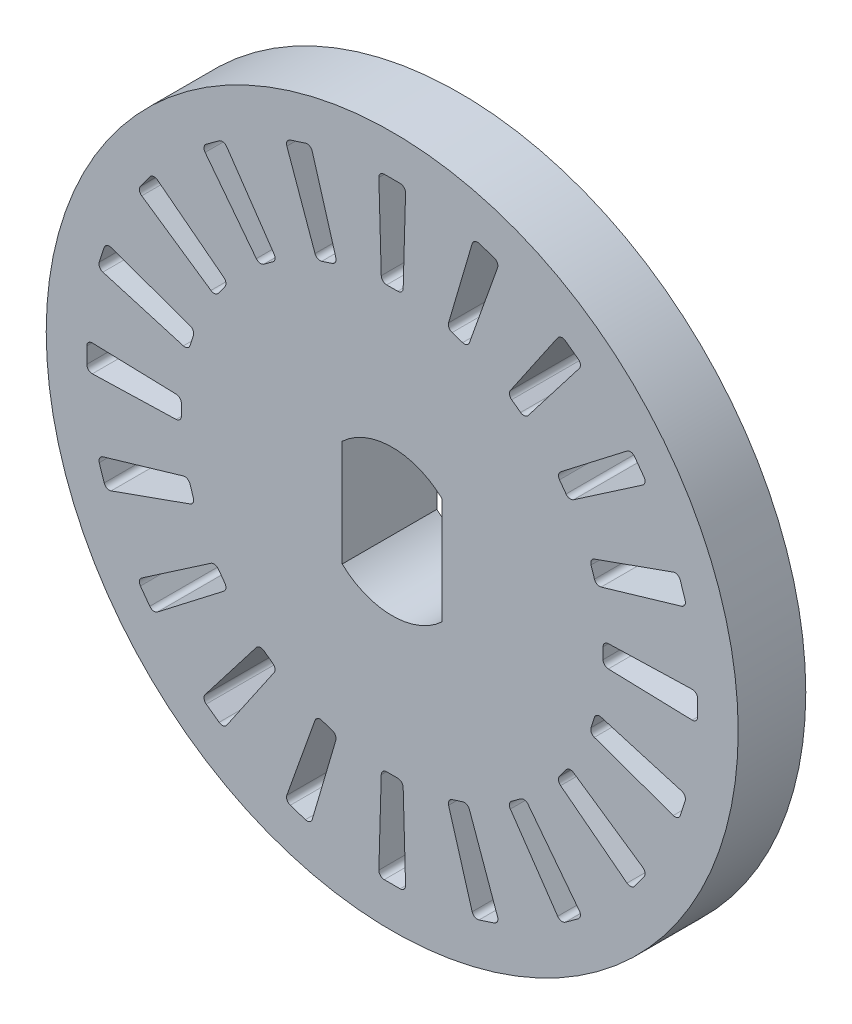
from build123d import *

# Parameters (mm, degrees)
CROQUIS1_R              = 12.8
SALIENTE_EXTRUIR1_DEPTH = 2.5
CORTAR_EXTRUIR1_DEPTH   = 7.5
SALIENTE_EXTRUIR2_START = 1
SALIENTE_EXTRUIR2_DEPTH = 1


with BuildPart() as part:
    # Croquis1 → Saliente-Extruir1 (new body)
    with BuildSketch(Plane.XY):
        Circle(CROQUIS1_R)
        with BuildLine():
            Line((1.85, -1.966596044), (1.85, 1.966596044))
            ThreePointArc((1.85, 1.966596044), (0, 2.7), (-1.85, 1.966596044))
            Line((-1.85, 1.966596044), (-1.85, -1.966596044))
            ThreePointArc((-1.85, -1.966596044), (0, -2.7), (1.85, -1.966596044))
        make_face(mode=Mode.SUBTRACT)
    extrude(amount=SALIENTE_EXTRUIR1_DEPTH)

    # Croquis2 → Cortar-Extruir1 (cut)
    with BuildSketch(Plane.XY):
        with BuildLine():
            Line((0.20563267, 7.8), (-0.20563267, 7.8))
            ThreePointArc((-0.20563267, 7.8), (-0.345019916, 7.856573379), (-0.405551087, 7.994288045))
            Line((-0.405551087, 7.994288045), (-0.494122516, 11.094288045))
            ThreePointArc((-0.494122516, 11.094288045), (-0.437630719, 11.239387247), (-0.294204098, 11.3))
            Line((-0.294204098, 11.3), (0.294204098, 11.3))
            ThreePointArc((0.294204098, 11.3), (0.437630719, 11.239387247), (0.494122516, 11.094288045))
            Line((0.494122516, 11.094288045), (0.405551087, 7.994288045))
            ThreePointArc((0.405551087, 7.994288045), (0.345019916, 7.856573379), (0.20563267, 7.8))
        make_face()
        with BuildLine():
            Line((2.605900847, 7.354696838), (2.214764266, 7.481784817))
            ThreePointArc((2.214764266, 7.481784817), (2.099681252, 7.578662326), (2.08466886, 7.728341917))
            Line((2.08466886, 7.728341917), (2.958385108, 10.703987194))
            ThreePointArc((2.958385108, 10.703987194), (3.056950119, 10.824527809), (3.212087312, 10.8378527))
            Line((3.212087312, 10.8378527), (3.771696761, 10.656024568))
            ThreePointArc((3.771696761, 10.656024568), (3.889373212, 10.554057151), (3.898261985, 10.398602684))
            Line((3.898261985, 10.398602684), (2.856072868, 7.477697561))
            ThreePointArc((2.856072868, 7.477697561), (2.755948131, 7.365428291), (2.605900847, 7.354696838))
        make_face()
        with BuildLine():
            Line((4.751085292, 6.189464705), (4.418364643, 6.431200407))
            ThreePointArc((4.418364643, 6.431200407), (4.33885099, 6.558899), (4.370826894, 6.705891835))
            Line((4.370826894, 6.705891835), (6.121305385, 9.265905497))
            ThreePointArc((6.121305385, 9.265905497), (6.25229538, 9.350088171), (6.403957236, 9.314820867))
            Line((6.403957236, 9.314820867), (6.879989466, 8.968963206))
            ThreePointArc((6.879989466, 8.968963206), (6.960396757, 8.835622406), (6.92081241, 8.685029642))
            Line((6.92081241, 8.685029642), (5.027022337, 6.229137939))
            ThreePointArc((5.027022337, 6.229137939), (4.897104942, 6.153303763), (4.751085292, 6.189464705))
        make_face()
        with BuildLine():
            Line((6.431200407, 4.418364643), (6.189464705, 4.751085292))
            ThreePointArc((6.189464705, 4.751085292), (6.153303763, 4.897104942), (6.229137939, 5.027022337))
            Line((6.229137939, 5.027022337), (8.685029642, 6.92081241))
            ThreePointArc((8.685029642, 6.92081241), (8.835622406, 6.960396757), (8.968963206, 6.879989466))
            Line((8.968963206, 6.879989466), (9.314820867, 6.403957236))
            ThreePointArc((9.314820867, 6.403957236), (9.350088171, 6.25229538), (9.265905497, 6.121305385))
            Line((9.265905497, 6.121305385), (6.705891835, 4.370826894))
            ThreePointArc((6.705891835, 4.370826894), (6.558899, 4.33885099), (6.431200407, 4.418364643))
        make_face()
        with BuildLine():
            Line((7.481784817, 2.214764266), (7.354696838, 2.605900847))
            ThreePointArc((7.354696838, 2.605900847), (7.365428291, 2.755948131), (7.477697561, 2.856072868))
            Line((7.477697561, 2.856072868), (10.398602684, 3.898261985))
            ThreePointArc((10.398602684, 3.898261985), (10.554057151, 3.889373212), (10.656024568, 3.771696761))
            Line((10.656024568, 3.771696761), (10.8378527, 3.212087312))
            ThreePointArc((10.8378527, 3.212087312), (10.824527809, 3.056950119), (10.703987194, 2.958385108))
            Line((10.703987194, 2.958385108), (7.728341917, 2.08466886))
            ThreePointArc((7.728341917, 2.08466886), (7.578662326, 2.099681252), (7.481784817, 2.214764266))
        make_face()
        with BuildLine():
            Line((7.8, -0.20563267), (7.8, 0.20563267))
            ThreePointArc((7.8, 0.20563267), (7.856573379, 0.345019916), (7.994288045, 0.405551087))
            Line((7.994288045, 0.405551087), (11.094288045, 0.494122516))
            ThreePointArc((11.094288045, 0.494122516), (11.239387247, 0.437630719), (11.3, 0.294204098))
            Line((11.3, 0.294204098), (11.3, -0.294204098))
            ThreePointArc((11.3, -0.294204098), (11.239387247, -0.437630719), (11.094288045, -0.494122516))
            Line((11.094288045, -0.494122516), (7.994288045, -0.405551087))
            ThreePointArc((7.994288045, -0.405551087), (7.856573379, -0.345019916), (7.8, -0.20563267))
        make_face()
        with BuildLine():
            Line((7.354696838, -2.605900847), (7.481784817, -2.214764266))
            ThreePointArc((7.481784817, -2.214764266), (7.578662326, -2.099681252), (7.728341917, -2.08466886))
            Line((7.728341917, -2.08466886), (10.703987194, -2.958385108))
            ThreePointArc((10.703987194, -2.958385108), (10.824527809, -3.056950119), (10.8378527, -3.212087312))
            Line((10.8378527, -3.212087312), (10.656024568, -3.771696761))
            ThreePointArc((10.656024568, -3.771696761), (10.554057151, -3.889373212), (10.398602684, -3.898261985))
            Line((10.398602684, -3.898261985), (7.477697561, -2.856072868))
            ThreePointArc((7.477697561, -2.856072868), (7.365428291, -2.755948131), (7.354696838, -2.605900847))
        make_face()
        with BuildLine():
            Line((6.189464705, -4.751085292), (6.431200407, -4.418364643))
            ThreePointArc((6.431200407, -4.418364643), (6.558899, -4.33885099), (6.705891835, -4.370826894))
            Line((6.705891835, -4.370826894), (9.265905497, -6.121305385))
            ThreePointArc((9.265905497, -6.121305385), (9.350088171, -6.25229538), (9.314820867, -6.403957236))
            Line((9.314820867, -6.403957236), (8.968963206, -6.879989466))
            ThreePointArc((8.968963206, -6.879989466), (8.835622406, -6.960396757), (8.685029642, -6.92081241))
            Line((8.685029642, -6.92081241), (6.229137939, -5.027022337))
            ThreePointArc((6.229137939, -5.027022337), (6.153303763, -4.897104942), (6.189464705, -4.751085292))
        make_face()
        with BuildLine():
            Line((4.418364643, -6.431200407), (4.751085292, -6.189464705))
            ThreePointArc((4.751085292, -6.189464705), (4.897104942, -6.153303763), (5.027022337, -6.229137939))
            Line((5.027022337, -6.229137939), (6.92081241, -8.685029642))
            ThreePointArc((6.92081241, -8.685029642), (6.960396757, -8.835622406), (6.879989466, -8.968963206))
            Line((6.879989466, -8.968963206), (6.403957236, -9.314820867))
            ThreePointArc((6.403957236, -9.314820867), (6.25229538, -9.350088171), (6.121305385, -9.265905497))
            Line((6.121305385, -9.265905497), (4.370826894, -6.705891835))
            ThreePointArc((4.370826894, -6.705891835), (4.33885099, -6.558899), (4.418364643, -6.431200407))
        make_face()
        with BuildLine():
            Line((2.214764266, -7.481784817), (2.605900847, -7.354696838))
            ThreePointArc((2.605900847, -7.354696838), (2.755948131, -7.365428291), (2.856072868, -7.477697561))
            Line((2.856072868, -7.477697561), (3.898261985, -10.398602684))
            ThreePointArc((3.898261985, -10.398602684), (3.889373212, -10.554057151), (3.771696761, -10.656024568))
            Line((3.771696761, -10.656024568), (3.212087312, -10.8378527))
            ThreePointArc((3.212087312, -10.8378527), (3.056950119, -10.824527809), (2.958385108, -10.703987194))
            Line((2.958385108, -10.703987194), (2.08466886, -7.728341917))
            ThreePointArc((2.08466886, -7.728341917), (2.099681252, -7.578662326), (2.214764266, -7.481784817))
        make_face()
        with BuildLine():
            Line((-0.20563267, -7.8), (0.20563267, -7.8))
            ThreePointArc((0.20563267, -7.8), (0.345019916, -7.856573379), (0.405551087, -7.994288045))
            Line((0.405551087, -7.994288045), (0.494122516, -11.094288045))
            ThreePointArc((0.494122516, -11.094288045), (0.437630719, -11.239387247), (0.294204098, -11.3))
            Line((0.294204098, -11.3), (-0.294204098, -11.3))
            ThreePointArc((-0.294204098, -11.3), (-0.437630719, -11.239387247), (-0.494122516, -11.094288045))
            Line((-0.494122516, -11.094288045), (-0.405551087, -7.994288045))
            ThreePointArc((-0.405551087, -7.994288045), (-0.345019916, -7.856573379), (-0.20563267, -7.8))
        make_face()
        with BuildLine():
            Line((-2.605900847, -7.354696838), (-2.214764266, -7.481784817))
            ThreePointArc((-2.214764266, -7.481784817), (-2.099681252, -7.578662326), (-2.08466886, -7.728341917))
            Line((-2.08466886, -7.728341917), (-2.958385108, -10.703987194))
            ThreePointArc((-2.958385108, -10.703987194), (-3.056950119, -10.824527809), (-3.212087312, -10.8378527))
            Line((-3.212087312, -10.8378527), (-3.771696761, -10.656024568))
            ThreePointArc((-3.771696761, -10.656024568), (-3.889373212, -10.554057151), (-3.898261985, -10.398602684))
            Line((-3.898261985, -10.398602684), (-2.856072868, -7.477697561))
            ThreePointArc((-2.856072868, -7.477697561), (-2.755948131, -7.365428291), (-2.605900847, -7.354696838))
        make_face()
        with BuildLine():
            Line((-4.751085292, -6.189464705), (-4.418364643, -6.431200407))
            ThreePointArc((-4.418364643, -6.431200407), (-4.33885099, -6.558899), (-4.370826894, -6.705891835))
            Line((-4.370826894, -6.705891835), (-6.121305385, -9.265905497))
            ThreePointArc((-6.121305385, -9.265905497), (-6.25229538, -9.350088171), (-6.403957236, -9.314820867))
            Line((-6.403957236, -9.314820867), (-6.879989466, -8.968963206))
            ThreePointArc((-6.879989466, -8.968963206), (-6.960396757, -8.835622406), (-6.92081241, -8.685029642))
            Line((-6.92081241, -8.685029642), (-5.027022337, -6.229137939))
            ThreePointArc((-5.027022337, -6.229137939), (-4.897104942, -6.153303763), (-4.751085292, -6.189464705))
        make_face()
        with BuildLine():
            Line((-6.431200407, -4.418364643), (-6.189464705, -4.751085292))
            ThreePointArc((-6.189464705, -4.751085292), (-6.153303763, -4.897104942), (-6.229137939, -5.027022337))
            Line((-6.229137939, -5.027022337), (-8.685029642, -6.92081241))
            ThreePointArc((-8.685029642, -6.92081241), (-8.835622406, -6.960396757), (-8.968963206, -6.879989466))
            Line((-8.968963206, -6.879989466), (-9.314820867, -6.403957236))
            ThreePointArc((-9.314820867, -6.403957236), (-9.350088171, -6.25229538), (-9.265905497, -6.121305385))
            Line((-9.265905497, -6.121305385), (-6.705891835, -4.370826894))
            ThreePointArc((-6.705891835, -4.370826894), (-6.558899, -4.33885099), (-6.431200407, -4.418364643))
        make_face()
        with BuildLine():
            Line((-7.481784817, -2.214764266), (-7.354696838, -2.605900847))
            ThreePointArc((-7.354696838, -2.605900847), (-7.365428291, -2.755948131), (-7.477697561, -2.856072868))
            Line((-7.477697561, -2.856072868), (-10.398602684, -3.898261985))
            ThreePointArc((-10.398602684, -3.898261985), (-10.554057151, -3.889373212), (-10.656024568, -3.771696761))
            Line((-10.656024568, -3.771696761), (-10.8378527, -3.212087312))
            ThreePointArc((-10.8378527, -3.212087312), (-10.824527809, -3.056950119), (-10.703987194, -2.958385108))
            Line((-10.703987194, -2.958385108), (-7.728341917, -2.08466886))
            ThreePointArc((-7.728341917, -2.08466886), (-7.578662326, -2.099681252), (-7.481784817, -2.214764266))
        make_face()
        with BuildLine():
            Line((-7.8, 0.20563267), (-7.8, -0.20563267))
            ThreePointArc((-7.8, -0.20563267), (-7.856573379, -0.345019916), (-7.994288045, -0.405551087))
            Line((-7.994288045, -0.405551087), (-11.094288045, -0.494122516))
            ThreePointArc((-11.094288045, -0.494122516), (-11.239387247, -0.437630719), (-11.3, -0.294204098))
            Line((-11.3, -0.294204098), (-11.3, 0.294204098))
            ThreePointArc((-11.3, 0.294204098), (-11.239387247, 0.437630719), (-11.094288045, 0.494122516))
            Line((-11.094288045, 0.494122516), (-7.994288045, 0.405551087))
            ThreePointArc((-7.994288045, 0.405551087), (-7.856573379, 0.345019916), (-7.8, 0.20563267))
        make_face()
        with BuildLine():
            Line((-7.354696838, 2.605900847), (-7.481784817, 2.214764266))
            ThreePointArc((-7.481784817, 2.214764266), (-7.578662326, 2.099681252), (-7.728341917, 2.08466886))
            Line((-7.728341917, 2.08466886), (-10.703987194, 2.958385108))
            ThreePointArc((-10.703987194, 2.958385108), (-10.824527809, 3.056950119), (-10.8378527, 3.212087312))
            Line((-10.8378527, 3.212087312), (-10.656024568, 3.771696761))
            ThreePointArc((-10.656024568, 3.771696761), (-10.554057151, 3.889373212), (-10.398602684, 3.898261985))
            Line((-10.398602684, 3.898261985), (-7.477697561, 2.856072868))
            ThreePointArc((-7.477697561, 2.856072868), (-7.365428291, 2.755948131), (-7.354696838, 2.605900847))
        make_face()
        with BuildLine():
            Line((-6.189464705, 4.751085292), (-6.431200407, 4.418364643))
            ThreePointArc((-6.431200407, 4.418364643), (-6.558899, 4.33885099), (-6.705891835, 4.370826894))
            Line((-6.705891835, 4.370826894), (-9.265905497, 6.121305385))
            ThreePointArc((-9.265905497, 6.121305385), (-9.350088171, 6.25229538), (-9.314820867, 6.403957236))
            Line((-9.314820867, 6.403957236), (-8.968963206, 6.879989466))
            ThreePointArc((-8.968963206, 6.879989466), (-8.835622406, 6.960396757), (-8.685029642, 6.92081241))
            Line((-8.685029642, 6.92081241), (-6.229137939, 5.027022337))
            ThreePointArc((-6.229137939, 5.027022337), (-6.153303763, 4.897104942), (-6.189464705, 4.751085292))
        make_face()
        with BuildLine():
            Line((-4.418364643, 6.431200407), (-4.751085292, 6.189464705))
            ThreePointArc((-4.751085292, 6.189464705), (-4.897104942, 6.153303763), (-5.027022337, 6.229137939))
            Line((-5.027022337, 6.229137939), (-6.92081241, 8.685029642))
            ThreePointArc((-6.92081241, 8.685029642), (-6.960396757, 8.835622406), (-6.879989466, 8.968963206))
            Line((-6.879989466, 8.968963206), (-6.403957236, 9.314820867))
            ThreePointArc((-6.403957236, 9.314820867), (-6.25229538, 9.350088171), (-6.121305385, 9.265905497))
            Line((-6.121305385, 9.265905497), (-4.370826894, 6.705891835))
            ThreePointArc((-4.370826894, 6.705891835), (-4.33885099, 6.558899), (-4.418364643, 6.431200407))
        make_face()
        with BuildLine():
            Line((-2.214764266, 7.481784817), (-2.605900847, 7.354696838))
            ThreePointArc((-2.605900847, 7.354696838), (-2.755948131, 7.365428291), (-2.856072868, 7.477697561))
            Line((-2.856072868, 7.477697561), (-3.898261985, 10.398602684))
            ThreePointArc((-3.898261985, 10.398602684), (-3.889373212, 10.554057151), (-3.771696761, 10.656024568))
            Line((-3.771696761, 10.656024568), (-3.212087312, 10.8378527))
            ThreePointArc((-3.212087312, 10.8378527), (-3.056950119, 10.824527809), (-2.958385108, 10.703987194))
            Line((-2.958385108, 10.703987194), (-2.08466886, 7.728341917))
            ThreePointArc((-2.08466886, 7.728341917), (-2.099681252, 7.578662326), (-2.214764266, 7.481784817))
        make_face()
    extrude(amount=CORTAR_EXTRUIR1_DEPTH, mode=Mode.SUBTRACT)

    # Croquis3 → Saliente-Extruir2 (add)
    with BuildSketch(Plane(origin=(0, 0, 0), x_dir=(-1, 0, 0), z_dir=(0, 0, -1)).offset(SALIENTE_EXTRUIR2_START)):
        with BuildLine():
            Line((2.85, -2.359555043), (2.85, 2.359555043))
            ThreePointArc((2.85, 2.359555043), (0, 3.7), (-2.85, 2.359555043))
            Line((-2.85, 2.359555043), (-2.85, -2.359555043))
            ThreePointArc((-2.85, -2.359555043), (0, -3.7), (2.85, -2.359555043))
        make_face()
        with BuildLine():
            Line((1.85, -1.966596044), (1.85, 1.966596044))
            ThreePointArc((1.85, 1.966596044), (0, 2.7), (-1.85, 1.966596044))
            Line((-1.85, 1.966596044), (-1.85, -1.966596044))
            ThreePointArc((-1.85, -1.966596044), (0, -2.7), (1.85, -1.966596044))
        make_face(mode=Mode.SUBTRACT)
    extrude(amount=-SALIENTE_EXTRUIR2_DEPTH)


solid = part.part
